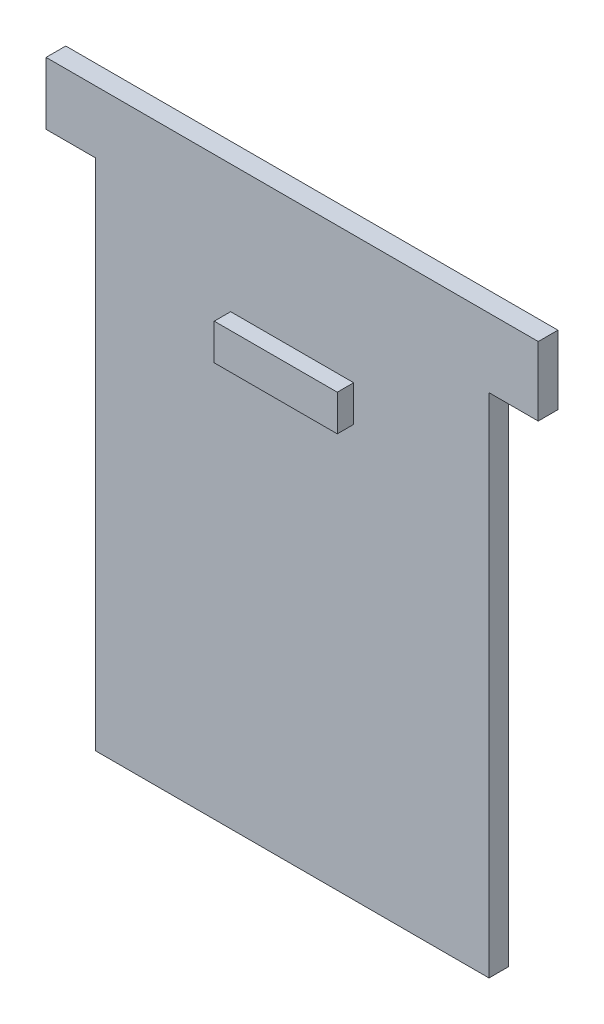
from build123d import *

# Parameters (mm, degrees)
BOSS_EXTRUDE1_DEPTH = 12
SKETCH2_W           = 75
SKETCH2_H           = 22
BOSS_EXTRUDE2_DEPTH = 10


with BuildPart() as part:
    # Sketch1 → Boss-Extrude1 (new body)
    with BuildSketch(Plane.XY):
        Polygon((0, 0), (300, 0), (300, -42), (270, -42), (270, -351), (30, -351), (30, -38), (0, -38), align=None)
    extrude(amount=BOSS_EXTRUDE1_DEPTH)

    # Sketch2 → Boss-Extrude2 (add)
    with BuildSketch(Plane.XY.offset(12)):
        with Locations((150, -89)):
            Rectangle(SKETCH2_W, SKETCH2_H)
    extrude(amount=BOSS_EXTRUDE2_DEPTH)


solid = part.part
